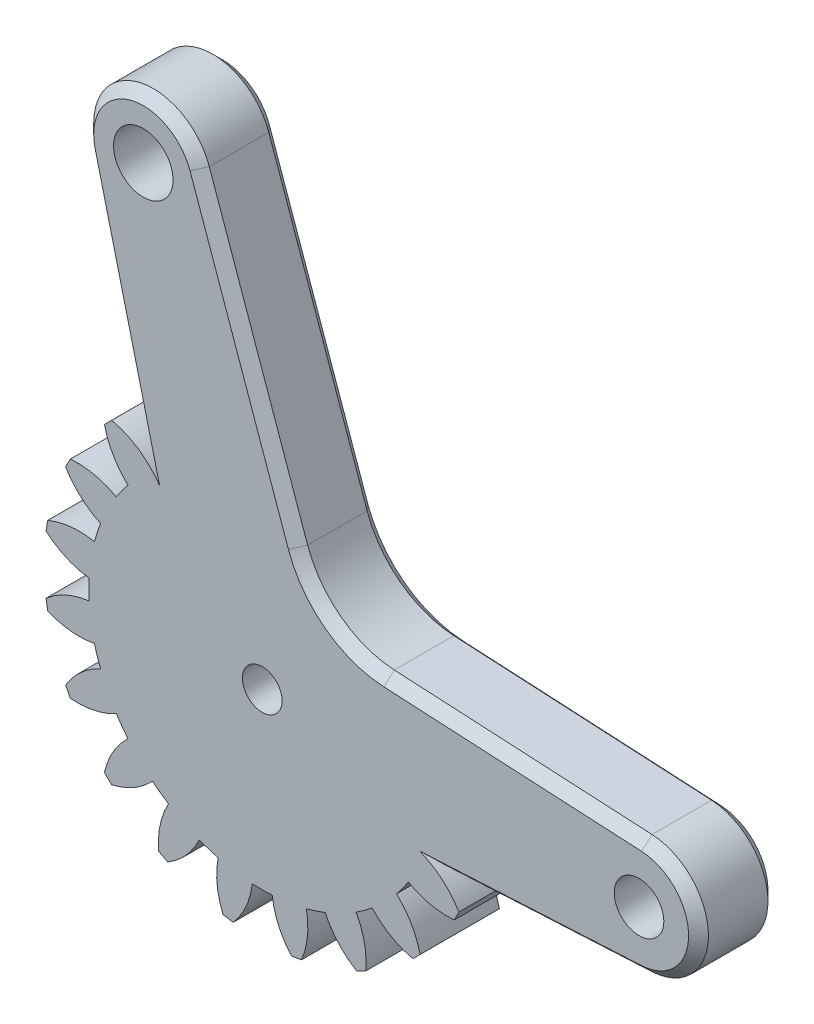
from build123d import *

# Parameters (mm, degrees)
CROQUIS7_R              = 11
CROQUIS7_R_2            = 1
SALIENTE_EXTRUIR4_DEPTH = 4
CORTAR_EXTRUIR3_DEPTH   = 17.062378404
MATRIZC3_COUNT          = 20
CROQUIS9_R              = 1
CROQUIS9_R_2            = 1.25
SALIENTE_EXTRUIR5_DEPTH = 4
CROQUIS2_R              = 1
CROQUIS2_R_2            = 1.5
SALIENTE_EXTRUIR2_DEPTH = 4
CORTAR_EXTRUIR4_DEPTH   = 33.078029865
CHAFL_N1_SIZE           = 0.5


with BuildPart() as part:
    # Croquis7 → Saliente-Extruir4 (new body)
    with BuildSketch(Plane.XY):
        Circle(CROQUIS7_R)
        Circle(CROQUIS7_R_2, mode=Mode.SUBTRACT)
    extrude(amount=-SALIENTE_EXTRUIR4_DEPTH)

    # Croquis10 → Cortar-Extruir3 (cut, through all)
    with BuildSketch(Plane.XY):
        with BuildLine():
            ThreePointArc((0.499924007, 8.734705318), (0, 8.749), (-0.499924007, 8.734705318))
            ThreePointArc((-0.499924007, 8.734705318), (-0.824302243, 9.905497836), (-1.485192705, 10.924909509))
            ThreePointArc((-1.485192705, 10.924909509), (0, 11.0254), (1.485192705, 10.924909509))
            ThreePointArc((1.485192705, 10.924909509), (0.824302243, 9.905497836), (0.499924007, 8.734705318))
        make_face()
    cortar_extruir3 = extrude(amount=-CORTAR_EXTRUIR3_DEPTH, mode=Mode.SUBTRACT)

    # MatrizC3: Cortar-Extruir3 ×20 about axis
    matrizc3_axis = Axis((0, 0, 0), (0, 0, 1))
    for i in range(1, MATRIZC3_COUNT):
        add(cortar_extruir3.rotate(matrizc3_axis, i * 360 / MATRIZC3_COUNT), mode=Mode.SUBTRACT)

    # Croquis9 → Saliente-Extruir5 (add)
    with BuildSketch(Plane.XY):
        with BuildLine():
            Line((0.210526316, 3.994455992), (19.157894737, 2.995841994))
            ThreePointArc((19.157894737, 2.995841994), (22, 0), (19.157894737, -2.995841994))
            Line((19.157894737, -2.995841994), (0.210526316, -3.994455992))
            ThreePointArc((0.210526316, -3.994455992), (-4, 0), (0.210526316, 3.994455992))
        make_face()
        Circle(CROQUIS9_R, mode=Mode.SUBTRACT)
        with Locations((19, 0)):
            Circle(CROQUIS9_R_2, mode=Mode.SUBTRACT)
    extrude(amount=-SALIENTE_EXTRUIR5_DEPTH)

    # Croquis2 → Saliente-Extruir2 (add, through all)
    with BuildSketch(Plane.XY.offset(-4)):
        with BuildLine():
            Line((-3.171102714, 20.998669186), (3.771863049, 1.331558915))
            ThreePointArc((3.771863049, 1.331558915), (1.149391542, -3.831305141), (-3.881954792, -0.964586438))
            Line((-3.881954792, -0.964586438), (-8.911466094, 19.276560172))
            ThreePointArc((-8.911466094, 19.276560172), (-6.862043657, 22.873478856), (-3.171102714, 20.998669186))
        make_face()
        Circle(CROQUIS2_R, mode=Mode.SUBTRACT)
        with Locations((-6, 20)):
            Circle(CROQUIS2_R_2, mode=Mode.SUBTRACT)
    extrude(amount=SALIENTE_EXTRUIR2_DEPTH)

    # Croquis11 → Cortar-Extruir4 (cut, through all)
    with BuildSketch(Plane(origin=(0, 0, -4), x_dir=(-1, 0, 0), z_dir=(0, 0, -1))):
        with BuildLine():
            Line((-0.780626911, 9.804734929), (-1.788639616, 6.949370564))
            ThreePointArc((-1.788639616, 6.949370564), (-3.478211644, 4.651731754), (-6.159867825, 3.680898163))
            Line((-6.159867825, 3.680898163), (-8.789028829, 3.542329211))
            Line((-8.789028829, 3.542329211), (-14.154797023, 5.193302426))
            Line((-14.154797023, 5.193302426), (-17.039697184, 17.319662426))
            Line((-17.039697184, 17.319662426), (-0.365952184, 17.319662426))
            Line((-0.365952184, 17.319662426), (-0.780626911, 9.804734929))
        make_face()
    extrude(amount=-CORTAR_EXTRUIR4_DEPTH, mode=Mode.SUBTRACT)

    # Chaflán1
    chafl_n1_edges = [part.edges().sort_by_distance(p)[0] for p in [
        (13.973461783, -3.269085602, -4),
        (12.658881281, 3.338370078, -4),
        (22, 0, -4),
        (13.973461783, -3.269085602, 0),
        (22, 0, 0),
        (12.658881281, 3.338370078, 0),
        (-0.691231549, 13.974019875, -4),
        (-7.399550596, 13.191892812, -4),
        (-0.691231549, 13.974019875, 0),
        (-6.862043657, 22.873478856, 0),
        (-7.399550596, 13.191892812, 0),
        (-6.862043657, 22.873478856, -4),
        (3.478211644, 4.651731754, -4),
        (3.478211644, 4.651731754, 0),
    ]]
    chamfer(chafl_n1_edges, length=CHAFL_N1_SIZE)


solid = part.part
